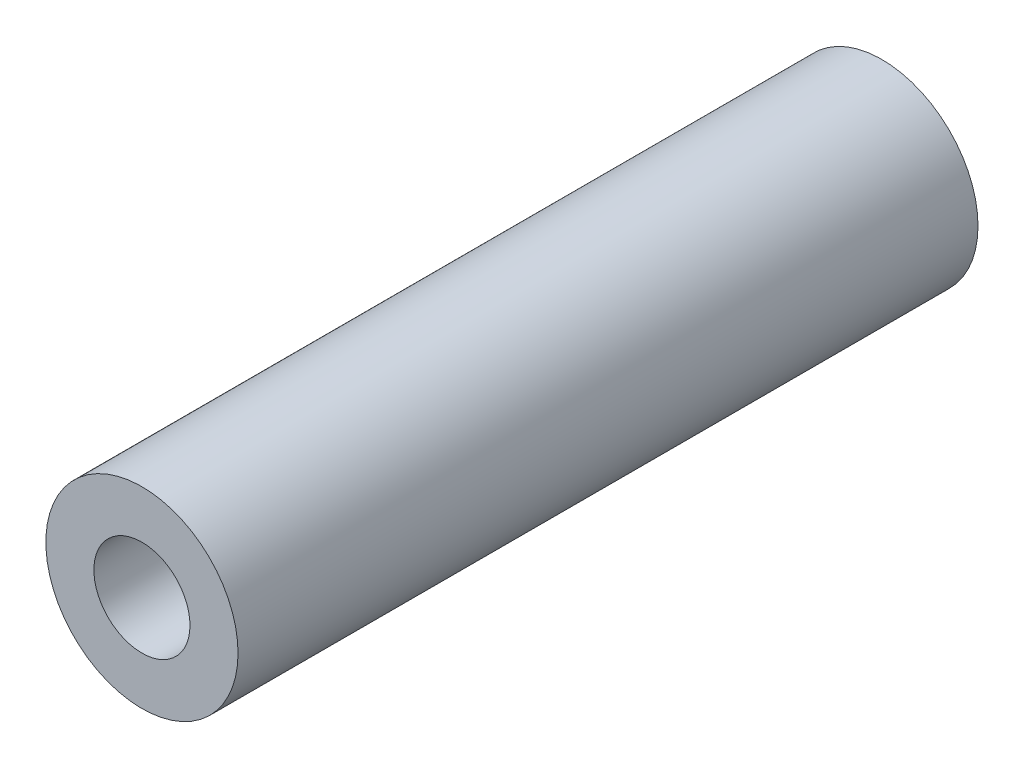
from build123d import *

# Parameters (mm, degrees)
SKETCH_1_R          = 3
EXTRUDE_1_DEPTH     = 23.1
SKETCH_2_R          = 1.5
CUT_EXTRUDE_1_DEPTH = 24.486379031


with BuildPart() as part:
    # 草图1 → 凸台-拉伸1 (new body)
    with BuildSketch(Plane.XY):
        Circle(SKETCH_1_R)
    extrude(amount=EXTRUDE_1_DEPTH)

    # 草图2 → 切除-拉伸1 (cut, through all)
    with BuildSketch(Plane.XY.offset(23.1)):
        Circle(SKETCH_2_R)
    extrude(amount=-CUT_EXTRUDE_1_DEPTH, mode=Mode.SUBTRACT)


solid = part.part
